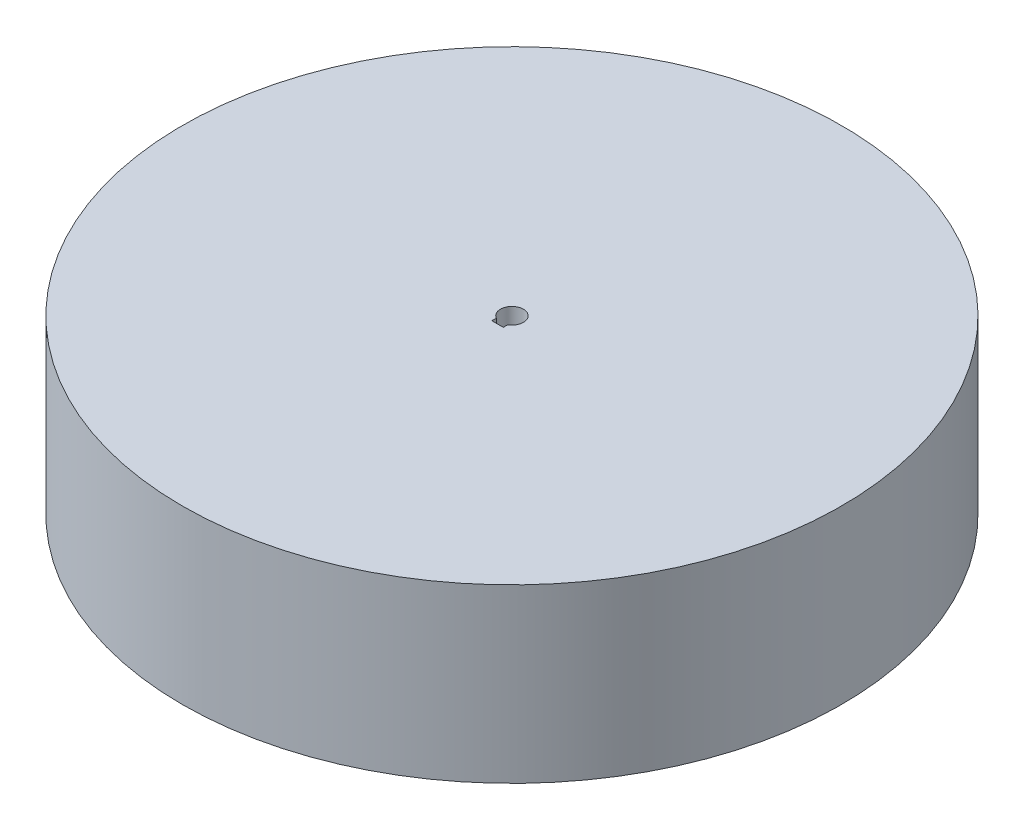
from build123d import *

# Parameters (mm, degrees)
SKETCH1_R           = 57.5
BOSS_EXTRUDE1_DEPTH = 30
CUT_EXTRUDE1_DEPTH  = 87.674679117


with BuildPart() as part:
    # Sketch1 → Boss-Extrude1 (new body)
    with BuildSketch(Plane(origin=(0, 0, 0), x_dir=(1, 0, 0), z_dir=(0, 1, 0))):
        with Locations(Location((0, 0, 0), (0, 0, 270))):
            Circle(SKETCH1_R)
    extrude(amount=BOSS_EXTRUDE1_DEPTH)

    # Sketch2 → Cut-Extrude1 (cut, through all)
    with BuildSketch(Plane.XZ):
        with BuildLine():
            Line((1, 1.732050808), (1, 2.5))
            Line((1, 2.5), (-1, 2.5))
            Line((-1, 2.5), (-1, 1.732050808))
            ThreePointArc((-1, 1.732050808), (0, -2), (1, 1.732050808))
        make_face()
    extrude(amount=-CUT_EXTRUDE1_DEPTH, mode=Mode.SUBTRACT)


solid = part.part
